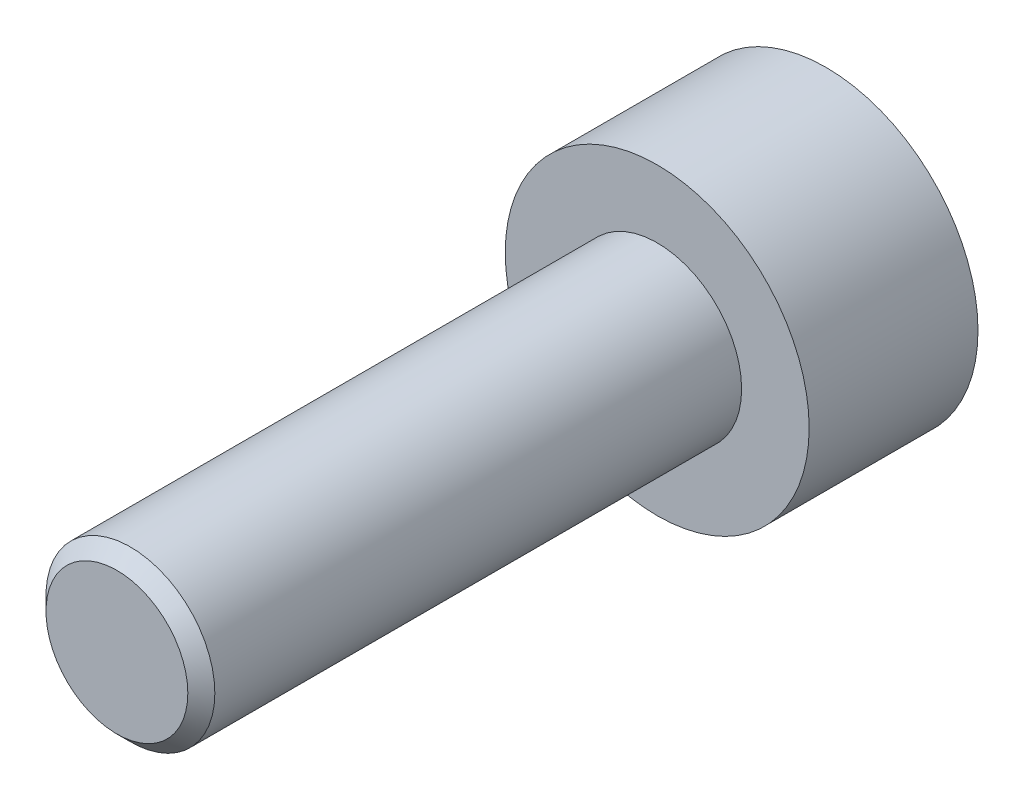
from build123d import *

# Parameters (mm, degrees)
SKETCH_1_R          = 2.25
EXTRUDE_1_DEPTH     = 2.5
SKETCH_2_R          = 1.25
EXTRUDE_2_DEPTH     = 8
CHAMFER_1_SIZE      = 0.2
CUT_EXTRUDE_1_DEPTH = 1.1


with BuildPart() as part:
    # 草图1 → 凸台-拉伸1 (new body)
    with BuildSketch(Plane.XY):
        Circle(SKETCH_1_R)
    extrude(amount=EXTRUDE_1_DEPTH)

    # 草图2 → 凸台-拉伸2 (add)
    with BuildSketch(Plane.XY.offset(2.5)):
        Circle(SKETCH_2_R)
    extrude(amount=EXTRUDE_2_DEPTH)

    # 倒角1
    chamfer_1_edges = [part.edges().sort_by_distance(p)[0] for p in [
        (-1.25, 0, 10.5),
    ]]
    chamfer(chamfer_1_edges, length=CHAMFER_1_SIZE)

    # 草图3 → 切除-拉伸1 (cut)
    with BuildSketch(Plane(origin=(0, 0, 0), x_dir=(-1, 0, 0), z_dir=(0, 0, -1))):
        Polygon((0, 1.177794549), (-1.02, 0.588897275), (-1.02, -0.588897275), (0, -1.177794549), (1.02, -0.588897275), (1.02, 0.588897275), align=None)
    extrude(amount=-CUT_EXTRUDE_1_DEPTH, mode=Mode.SUBTRACT)


solid = part.part
